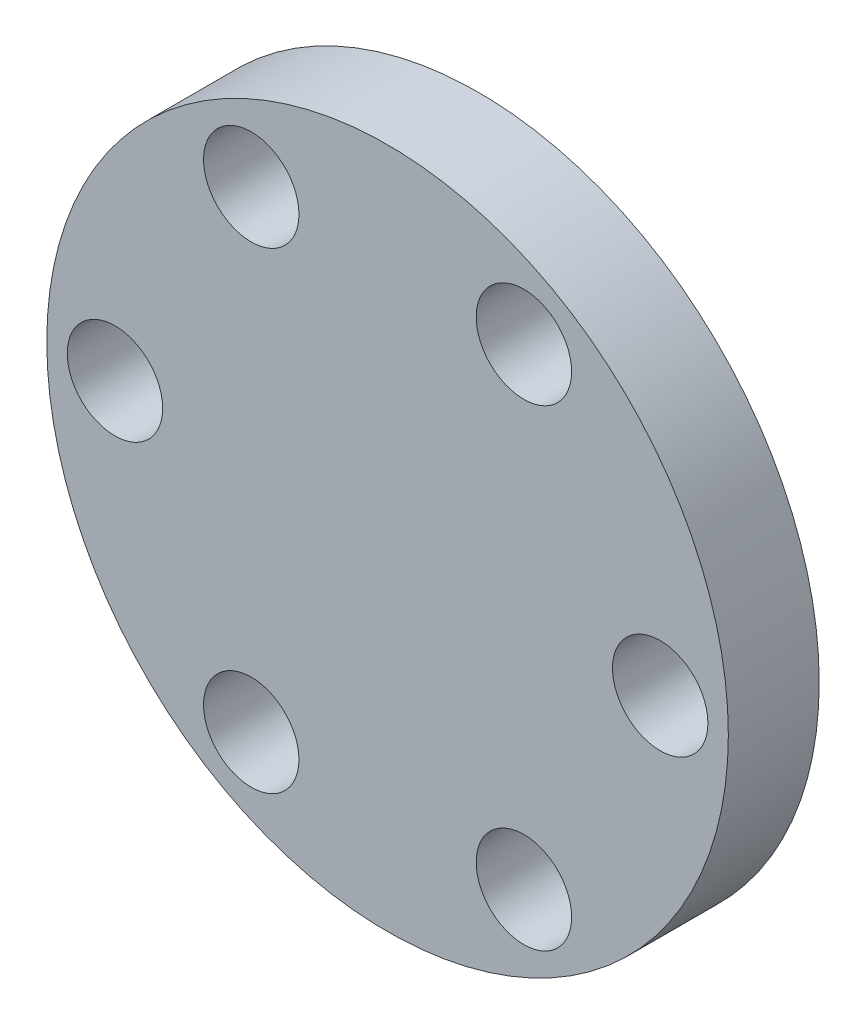
from build123d import *

# Parameters (mm, degrees)
SKETCH1_R           = 15
SKETCH1_R_2         = 2.1
BOSS_EXTRUDE1_DEPTH = 2


with BuildPart() as part:
    # Sketch1 → Boss-Extrude1 (new, symmetric)
    with BuildSketch(Plane(origin=(0, 0, 0), x_dir=(0, 1, 0), z_dir=(0, 0, 1))):
        with Locations(Location((0, 0, 0), (0, 0, 270))):
            Circle(SKETCH1_R)
        with Locations(Location((0, 12, 0), (0, 0, 270))):
            Circle(SKETCH1_R_2, mode=Mode.SUBTRACT)
        with Locations(Location((10.392304845, 6, 0), (0, 0, 270))):
            Circle(SKETCH1_R_2, mode=Mode.SUBTRACT)
        with Locations(Location((10.392304845, -6, 0), (0, 0, 270))):
            Circle(SKETCH1_R_2, mode=Mode.SUBTRACT)
        with Locations(Location((0, -12, 0), (0, 0, 270))):
            Circle(SKETCH1_R_2, mode=Mode.SUBTRACT)
        with Locations(Location((-10.392304845, -6, 0), (0, 0, 270))):
            Circle(SKETCH1_R_2, mode=Mode.SUBTRACT)
        with Locations(Location((-10.392304845, 6, 0), (0, 0, 270))):
            Circle(SKETCH1_R_2, mode=Mode.SUBTRACT)
    extrude(amount=BOSS_EXTRUDE1_DEPTH, both=True)


solid = part.part
